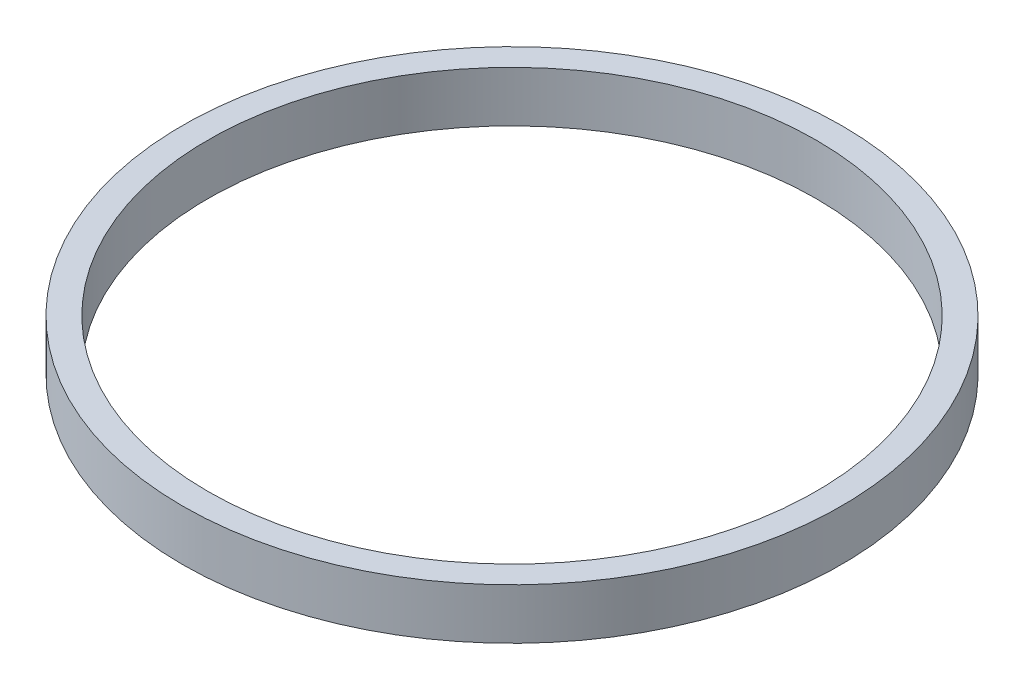
from build123d import *

# Parameters (mm, degrees)
ESQUISSE1_R        = 6.5
ESQUISSE1_R_2      = 6
BOSS_EXTRU_1_DEPTH = 1


with BuildPart() as part:
    # Esquisse1 → Boss.-Extru.1 (new body)
    with BuildSketch(Plane(origin=(0, 0, 0), x_dir=(1, 0, 0), z_dir=(0, 1, 0))):
        with Locations(Location((0, 0, 0), (0, 0, 270))):
            Circle(ESQUISSE1_R)
        with Locations(Location((0, 0, 0), (0, 0, 270))):
            Circle(ESQUISSE1_R_2, mode=Mode.SUBTRACT)
    extrude(amount=BOSS_EXTRU_1_DEPTH)


solid = part.part
